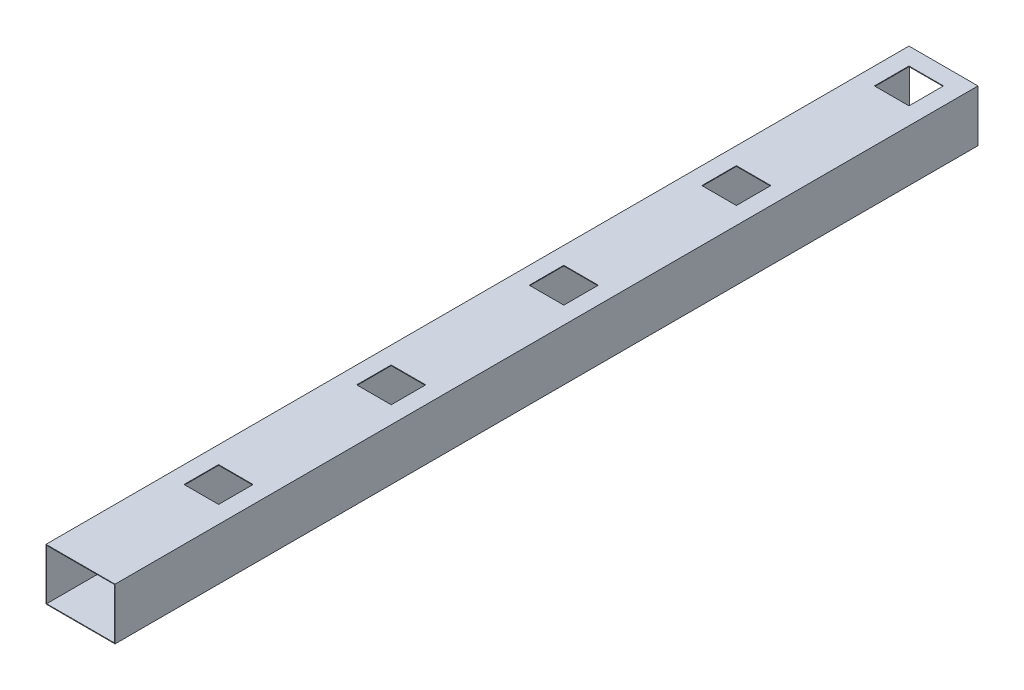
from build123d import *

# Parameters (mm, degrees)
SKETCH_1_W             = 80
SKETCH_1_H             = 60
SKETCH_1_W_2           = 78.6
SKETCH_1_H_2           = 58.6
EXTRUDE_1_DEPTH        = 1000
CUT_EXTRUDE_1_REACH    = 1004.597
SKETCH_2_W             = 40
SKETCH_2_H             = 40
PATTERN_LINEAR_1_COUNT = 5
PATTERN_LINEAR_1_PITCH = 200


with BuildPart() as part:
    # 스케치1 → 보스-돌출1 (new body)
    with BuildSketch(Plane.XY):
        Rectangle(SKETCH_1_W, SKETCH_1_H)
        Rectangle(SKETCH_1_W_2, SKETCH_1_H_2, mode=Mode.SUBTRACT)
    extrude(amount=EXTRUDE_1_DEPTH)

    # 스케치2 → 컷-돌출1 (cut, up to next)
    with BuildSketch(Plane(origin=(0, 30, 0), x_dir=(1, 0, 0), z_dir=(0, 1, 0)), mode=Mode.PRIVATE) as cut_extrude_1_sk1:
        with Locations((0, -40)):
            Rectangle(SKETCH_2_W, SKETCH_2_H)
    cut_extrude_1_tool1 = extrude(cut_extrude_1_sk1.sketch, amount=-CUT_EXTRUDE_1_REACH, mode=Mode.PRIVATE) & part.part
    cut_extrude_1 = cut_extrude_1_tool1.solids().sort_by_distance((0, 30, 40))[0]
    add(cut_extrude_1, mode=Mode.SUBTRACT)

    # 선형 패턴1: 컷-돌출1 ×5
    with Locations(*[(0, 0, i * PATTERN_LINEAR_1_PITCH) for i in range(1, PATTERN_LINEAR_1_COUNT)]):
        add(cut_extrude_1, mode=Mode.SUBTRACT)


solid = part.part
